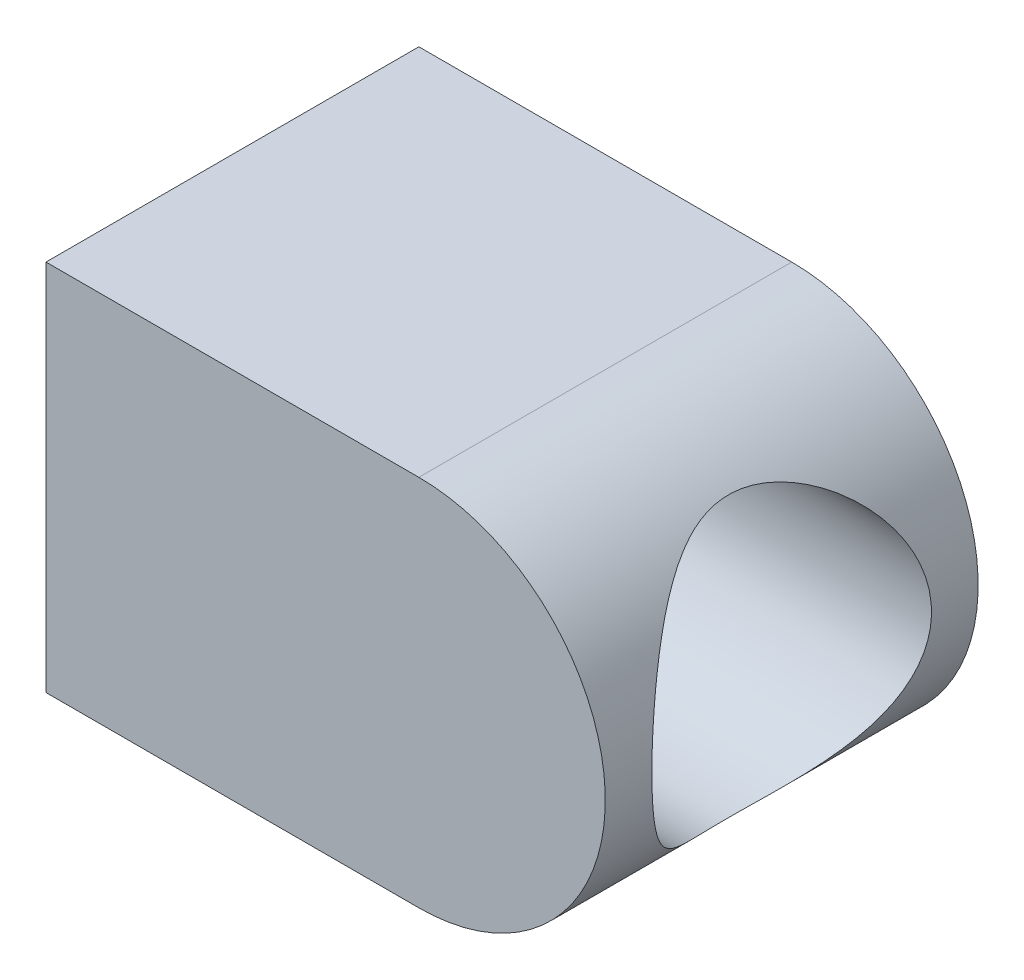
from build123d import *

# Parameters (mm, degrees)
SKETCH1_W           = 20
SKETCH1_H           = 20
BOSS_EXTRUDE1_DEPTH = 30
FILLET3_RADIUS      = 10
FILLET3_LENGTH      = 20
SKETCH2_R           = 7.5
CUT_EXTRUDE1_DEPTH  = 30


with BuildPart() as part:
    # Sketch1 → Boss-Extrude1 (new body)
    with BuildSketch(Plane(origin=(0, 0, 0), x_dir=(0, 0, -1), z_dir=(1, 0, 0))):
        Rectangle(SKETCH1_W, SKETCH1_H)
    extrude(amount=BOSS_EXTRUDE1_DEPTH)

    # Fillet3: full round fillet: the end face becomes a half cylinder, R = half its width
    fillet3_face = Plane((30, 0, 0), x_dir=(0, 0, 1), z_dir=(1, 0, 0))  # on the end face: x along it, z out of the body
    fillet3_slab = fillet3_face.offset(-FILLET3_RADIUS / 2) * Box(FILLET3_LENGTH, 2 * FILLET3_RADIUS, FILLET3_RADIUS, mode=Mode.PRIVATE)  # the body's end, R deep
    fillet3_round = Plane((20, 0, 0), x_dir=(1, 0, 0), z_dir=(0, 0, 1)) * Cylinder(FILLET3_RADIUS, FILLET3_LENGTH, mode=Mode.PRIVATE)  # its axis R under the face
    add(fillet3_slab - fillet3_round, mode=Mode.SUBTRACT)

    # Sketch2 → Cut-Extrude1 (cut)
    with BuildSketch(Plane.ZY):
        Circle(SKETCH2_R)
    extrude(amount=-CUT_EXTRUDE1_DEPTH, mode=Mode.SUBTRACT)


solid = part.part
